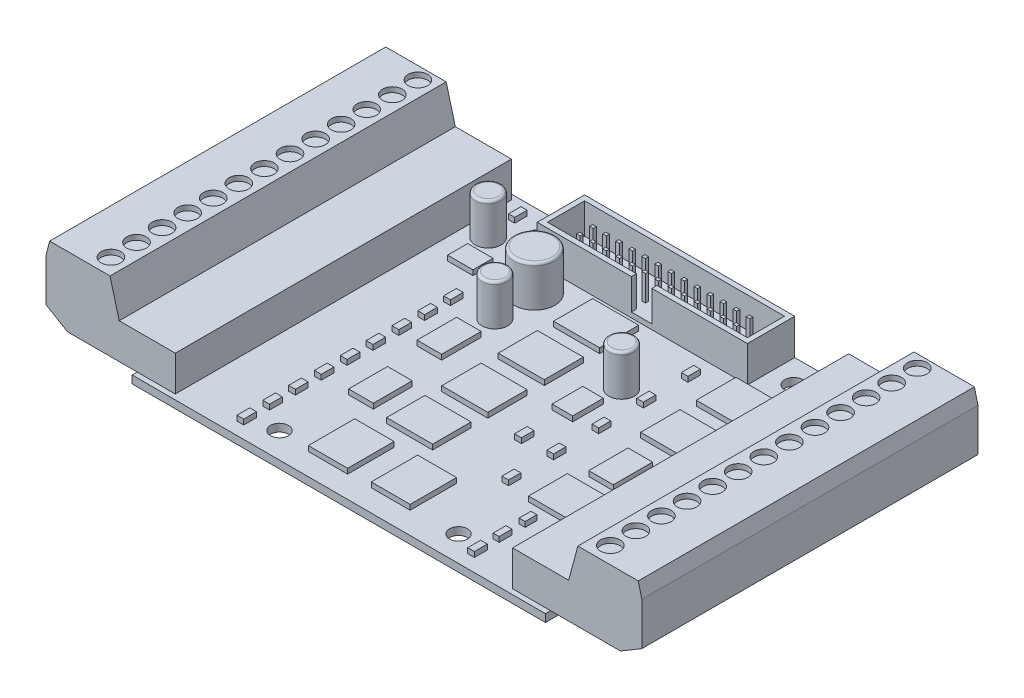
from build123d import *

# Parameters (mm, degrees)
SKETCH3_W           = 80.8
SKETCH3_H           = 67.7
SKETCH3_R           = 1.75
BOSS_EXTRUDE1_DEPTH = 1.5
SKETCH4_R           = 2.519657783
SKETCH4_R_2         = 4.004532687
SKETCH4_R_3         = 2.500407143
SKETCH4_R_4         = 2.502335513
SKETCH4_W           = 41.074253189
SKETCH4_H           = 9.252443791
SKETCH4_W_2         = 1.329022596
SKETCH4_H_2         = 2.489291791
SKETCH4_W_3         = 9.043722833
SKETCH4_H_3         = 7.744624526
SKETCH4_W_4         = 1.299098307
SKETCH4_H_4         = 2.423317997
SKETCH4_H_5         = 7.682547563
SKETCH4_H_6         = 2.438903988
SKETCH4_W_5         = 4.020192685
SKETCH4_H_7         = 6.000287589
SKETCH4_H_8         = 2.360113118
SKETCH4_W_6         = 4.798826301
SKETCH4_H_9         = 7.680510278
SKETCH4_W_7         = 8.973213678
SKETCH4_H_10        = 7.581709379
SKETCH4_W_8         = 8.999226764
SKETCH4_H_11        = 7.637060925
SKETCH4_H_12        = 7.638680033
SKETCH4_H_13        = 7.508285648
SKETCH4_W_9         = 1.353534488
SKETCH4_H_14        = 2.45168511
SKETCH4_H_15        = 2.426146723
SKETCH4_H_16        = 2.400608337
SKETCH4_W_10        = 1.177406115
SKETCH4_H_17        = 2.296944798
SKETCH4_H_18        = 2.498319459
SKETCH4_W_11        = 1.305968843
SKETCH4_H_19        = 2.531853948
SKETCH4_W_12        = 7.592772193
SKETCH4_H_20        = 9.071883658
SKETCH4_W_13        = 7.685500939
SKETCH4_W_14        = 4.831402337
SKETCH4_H_21        = 7.597617008
SKETCH4_W_15        = 4.794287262
SKETCH4_H_22        = 7.724129478
SKETCH4_W_16        = 4.959992836
SKETCH4_H_23        = 3.915783819
SKETCH4_W_17        = 1.208713917
SKETCH4_H_24        = 2.423087071
BOSS_EXTRUDE2_DEPTH = 1
BOSS_EXTRUDE3_START = -1
BOSS_EXTRUDE3_DEPTH = 65.7
BOSS_EXTRUDE4_DEPTH = 6
SKETCH6_3_W         = 0.702805105
SKETCH6_3_H         = 0.590356289
BOSS_EXTRUDE5_DEPTH = 5
SKETCH8_R           = 2.502335513
SKETCH8_R_2         = 2.500407143
SKETCH8_R_3         = 4.004532687
SKETCH8_R_4         = 2.519657783
BOSS_EXTRUDE6_DEPTH = 7
FILLET1_R           = 0.5
SKETCH9_R           = 1.912381088
CUT_EXTRUDE1_DEPTH  = 1


with BuildPart() as part:
    # Sketch3 → Boss-Extrude1 (new body)
    with BuildSketch(Plane(origin=(0, 0, 0), x_dir=(1, 0, 0), z_dir=(0, 1, 0))):
        Rectangle(SKETCH3_W, SKETCH3_H)
        with Locations(Location((-24.1, 29.15, 0), (0, 0, 270))):
            Circle(SKETCH3_R, mode=Mode.SUBTRACT)
        with Locations(Location((25.9, 29.15, 0), (0, 0, 270))):
            Circle(SKETCH3_R, mode=Mode.SUBTRACT)
        with Locations(Location((-16.6, -28.85, 0), (0, 0, 270))):
            Circle(SKETCH3_R, mode=Mode.SUBTRACT)
        with Locations(Location((18.4, -28.85, 0), (0, 0, 270))):
            Circle(SKETCH3_R, mode=Mode.SUBTRACT)
    extrude(amount=-BOSS_EXTRUDE1_DEPTH)

    # Sketch4 → Boss-Extrude2 (add)
    with BuildSketch(Plane(origin=(0, 0, 0), x_dir=(1, 0, 0), z_dir=(0, 1, 0))):
        with Locations(Location((-28.860526391, 24.21099068, 0), (0, 0, 270))):
            Circle(SKETCH4_R)
        with Locations(Location((-14.884448673, 19.266256309, 0), (0, 0, 270))):
            Circle(SKETCH4_R_2)
        with Locations(Location((-14.508312328, 11.15757865, 0), (0, 0, 270))):
            Circle(SKETCH4_R_3)
        with Locations(Location((9.776748131, 11.644789555, 0), (0, 0, 270))):
            Circle(SKETCH4_R_4)
        with Locations((0.869107225, 29.223778104)):
            Rectangle(SKETCH4_W, SKETCH4_H)
        with Locations((-21.694211323, 5.19158196)):
            Rectangle(SKETCH4_W_2, SKETCH4_H_2)
        with Locations((24.518139021, 19.892380071)):
            Rectangle(SKETCH4_W_3, SKETCH4_H_3)
        with Locations((14.500092457, 20.454489916)):
            Rectangle(SKETCH4_W_4, SKETCH4_H_4)
        with Locations((24.518139021, 8.996936065)):
            Rectangle(SKETCH4_W_3, SKETCH4_H_5)
        with Locations((14.500092457, 11.740703051)):
            Rectangle(SKETCH4_W_4, SKETCH4_H_6)
        with Locations((8.572453919, 4.27514885)):
            Rectangle(SKETCH4_W_5, SKETCH4_H_7)
        with Locations((14.500092457, 2.97508654)):
            Rectangle(SKETCH4_W_4, SKETCH4_H_8)
        with Locations((23.80564697, -2.565250083)):
            Rectangle(SKETCH4_W_6, SKETCH4_H_9)
        with Locations((24.311699922, -12.793514635)):
            Rectangle(SKETCH4_W_7, SKETCH4_H_10)
        with Locations((-2.829725204, 19.269771126)):
            Rectangle(SKETCH4_W_8, SKETCH4_H_11)
        with Locations((-2.829725204, 8.460957221)):
            Rectangle(SKETCH4_W_8, SKETCH4_H_12)
        with Locations((-2.829725204, -2.565250083)):
            Rectangle(SKETCH4_W_8, SKETCH4_H_9)
        with Locations((-2.829725204, -13.425306404)):
            Rectangle(SKETCH4_W_8, SKETCH4_H_13)
        with Locations((8.595687933, -6.197943008)):
            Rectangle(SKETCH4_W_9, SKETCH4_H_14)
        with Locations((14.500092457, -5.827636403)):
            Rectangle(SKETCH4_W_4, SKETCH4_H_15)
        with Locations((14.500092457, -14.625610573)):
            Rectangle(SKETCH4_W_4, SKETCH4_H_16)
        with Locations((23.216943912, -20.096080994)):
            Rectangle(SKETCH4_W_10, SKETCH4_H_17)
        with Locations((23.216943912, -25.067859946)):
            Rectangle(SKETCH4_W_10, SKETCH4_H_18)
        with Locations((23.281225277, -30.014197129)):
            Rectangle(SKETCH4_W_11, SKETCH4_H_19)
        with Locations((5.863688442, -25.034462774)):
            Rectangle(SKETCH4_W_12, SKETCH4_H_20)
        with Locations((-6.394292213, -25.034462774)):
            Rectangle(SKETCH4_W_13, SKETCH4_H_20)
        with Locations((-13.471115738, -12.248661286)):
            Rectangle(SKETCH4_W_14, SKETCH4_H_21)
        with Locations((-15.067275939, 2.77141156)):
            Rectangle(SKETCH4_W_15, SKETCH4_H_22)
        with Locations((-26.379970272, 18.230236397)):
            Rectangle(SKETCH4_W_16, SKETCH4_H_23)
        with Locations((-29.300812929, 30.43532164)):
            Rectangle(SKETCH4_W_17, SKETCH4_H_24)
        with Locations((-21.694211323, 10.241581959)):
            Rectangle(SKETCH4_W_2, SKETCH4_H_2)
        with Locations((-21.694211323, 0.141581959)):
            Rectangle(SKETCH4_W_2, SKETCH4_H_2)
        with Locations((-21.694211323, -4.908418041)):
            Rectangle(SKETCH4_W_2, SKETCH4_H_2)
        with Locations((-21.694211323, -9.95841804)):
            Rectangle(SKETCH4_W_2, SKETCH4_H_2)
        with Locations((-21.694211323, -15.008418041)):
            Rectangle(SKETCH4_W_2, SKETCH4_H_2)
        with Locations((-21.694211323, -20.058418041)):
            Rectangle(SKETCH4_W_2, SKETCH4_H_2)
        with Locations((-21.694211323, -25.108418041)):
            Rectangle(SKETCH4_W_2, SKETCH4_H_2)
        with Locations((-21.694211323, -30.158418041)):
            Rectangle(SKETCH4_W_2, SKETCH4_H_2)
    extrude(amount=BOSS_EXTRUDE2_DEPTH)

    # Sketch5 → Boss-Extrude3 (add)
    with BuildSketch(Plane.XY.offset(33.85).offset(BOSS_EXTRUDE3_START)):
        Polygon((-54.037193692, 0), (-32.958481681, 0), (-32.958481681, 6.91967846), (-43.923571691, 6.91967846), (-45.717519111, 13.609607381), (-57.524257941, 13.609607381), (-58.228687354, 10.83885169), (-58.228687354, 2.496386084), align=None)
        Polygon((32.958481681, 6.91967846), (32.958481681, 0), (54.037193692, 0), (58.228687354, 2.496386084), (58.228687354, 10.83885169), (57.524257941, 13.609607381), (45.717519111, 13.609607381), (43.923571691, 6.91967846), align=None)
    extrude(amount=-BOSS_EXTRUDE3_DEPTH)

    # Sketch6 → Boss-Extrude4 (add)
    with BuildSketch(Plane(origin=(0, 1, 0), x_dir=(1, 0, 0), z_dir=(0, 1, 0))):
        Polygon((2.733685616, 25.597556209), (2.733685616, 24.597556209), (21.406233819, 24.597556209), (21.406233819, 33.85), (-19.66801937, 33.85), (-19.66801937, 24.597556209), (-1.266314384, 24.597556209), (-1.266314384, 25.597556209), (-18.66801937, 25.597556209), (-18.66801937, 32.85), (20.406233819, 32.85), (20.406233819, 25.597556209), align=None)
    extrude(amount=BOSS_EXTRUDE4_DEPTH)

    # Sketch6<3> → Boss-Extrude5 (add)
    with BuildSketch(Plane(origin=(0, 1, 0), x_dir=(1, 0, 0), z_dir=(0, 1, 0))):
        with Locations((-14.50705477, 30.327179555)):
            Rectangle(SKETCH6_3_W, SKETCH6_3_H)
        with Locations((-11.95705477, 30.327179555)):
            Rectangle(SKETCH6_3_W, SKETCH6_3_H)
        with Locations((-9.40705477, 30.327179555)):
            Rectangle(SKETCH6_3_W, SKETCH6_3_H)
        with Locations((-6.85705477, 30.327179555)):
            Rectangle(SKETCH6_3_W, SKETCH6_3_H)
        with Locations((-14.50705477, 27.777179555)):
            Rectangle(SKETCH6_3_W, SKETCH6_3_H)
        with Locations((-11.95705477, 27.777179555)):
            Rectangle(SKETCH6_3_W, SKETCH6_3_H)
        with Locations((-9.40705477, 27.777179555)):
            Rectangle(SKETCH6_3_W, SKETCH6_3_H)
        with Locations((-6.85705477, 27.777179555)):
            Rectangle(SKETCH6_3_W, SKETCH6_3_H)
        with Locations((-4.30705477, 30.327179555)):
            Rectangle(SKETCH6_3_W, SKETCH6_3_H)
        with Locations((-4.30705477, 27.777179555)):
            Rectangle(SKETCH6_3_W, SKETCH6_3_H)
        with Locations((-1.75705477, 30.327179555)):
            Rectangle(SKETCH6_3_W, SKETCH6_3_H)
        with Locations((-1.75705477, 27.777179555)):
            Rectangle(SKETCH6_3_W, SKETCH6_3_H)
        with Locations((0.792945231, 30.327179555)):
            Rectangle(SKETCH6_3_W, SKETCH6_3_H)
        with Locations((0.792945231, 27.777179555)):
            Rectangle(SKETCH6_3_W, SKETCH6_3_H)
        with Locations((3.342945231, 30.327179555)):
            Rectangle(SKETCH6_3_W, SKETCH6_3_H)
        with Locations((3.342945231, 27.777179555)):
            Rectangle(SKETCH6_3_W, SKETCH6_3_H)
        with Locations((5.892945231, 30.327179555)):
            Rectangle(SKETCH6_3_W, SKETCH6_3_H)
        with Locations((5.892945231, 27.777179555)):
            Rectangle(SKETCH6_3_W, SKETCH6_3_H)
        with Locations((8.442945231, 30.327179555)):
            Rectangle(SKETCH6_3_W, SKETCH6_3_H)
        with Locations((8.442945231, 27.777179555)):
            Rectangle(SKETCH6_3_W, SKETCH6_3_H)
        with Locations((10.992945231, 30.327179555)):
            Rectangle(SKETCH6_3_W, SKETCH6_3_H)
        with Locations((10.992945231, 27.777179555)):
            Rectangle(SKETCH6_3_W, SKETCH6_3_H)
        with Locations((13.542945231, 30.327179555)):
            Rectangle(SKETCH6_3_W, SKETCH6_3_H)
        with Locations((13.542945231, 27.777179555)):
            Rectangle(SKETCH6_3_W, SKETCH6_3_H)
        with Locations((16.09294523, 30.327179555)):
            Rectangle(SKETCH6_3_W, SKETCH6_3_H)
        with Locations((16.09294523, 27.777179555)):
            Rectangle(SKETCH6_3_W, SKETCH6_3_H)
    extrude(amount=BOSS_EXTRUDE5_DEPTH)

    # Sketch8 → Boss-Extrude6 (add)
    with BuildSketch(Plane(origin=(0, 1, 0), x_dir=(1, 0, 0), z_dir=(0, 1, 0))):
        with Locations(Location((9.776748131, 11.644789555, 0), (0, 0, 270))):
            Circle(SKETCH8_R)
        with Locations(Location((-14.508312328, 11.15757865, 0), (0, 0, 270))):
            Circle(SKETCH8_R_2)
        with Locations(Location((-14.884448673, 19.266256309, 0), (0, 0, 270))):
            Circle(SKETCH8_R_3)
        with Locations(Location((-28.860526391, 24.21099068, 0), (0, 0, 270))):
            Circle(SKETCH8_R_4)
    extrude(amount=BOSS_EXTRUDE6_DEPTH)

    # Fillet1
    fillet1_edges = [part.edges().sort_by_distance(p)[0] for p in [
        (9.776748131, 8, -14.147125068),
        (-14.508312328, 8, -13.657985793),
        (-14.884448673, 8, -23.270788997),
        (-28.860526391, 8, -26.730648463),
    ]]
    fillet(fillet1_edges, radius=FILLET1_R)

    # Sketch9 → Cut-Extrude1 (cut)
    with BuildSketch(Plane(origin=(0, 13.609607381, 0), x_dir=(1, 0, 0), z_dir=(0, 1, 0))):
        with Locations(Location((-48.800237871, 30.412257538, 0), (0, 0, 180))):
            Circle(SKETCH9_R)
        with Locations(Location((-48.800237871, 25.412257538, 0), (0, 0, 180))):
            Circle(SKETCH9_R)
        with Locations(Location((-48.800237871, 20.412257538, 0), (0, 0, 180))):
            Circle(SKETCH9_R)
        with Locations(Location((-48.800237871, 15.412257538, 0), (0, 0, 180))):
            Circle(SKETCH9_R)
        with Locations(Location((-48.800237871, 10.412257538, 0), (0, 0, 180))):
            Circle(SKETCH9_R)
        with Locations(Location((-48.800237871, 5.412257538, 0), (0, 0, 180))):
            Circle(SKETCH9_R)
        with Locations(Location((-48.800237871, 0.412257538, 0), (0, 0, 180))):
            Circle(SKETCH9_R)
        with Locations(Location((-48.800237871, -4.587742462, 0), (0, 0, 180))):
            Circle(SKETCH9_R)
        with Locations(Location((-48.800237871, -9.587742462, 0), (0, 0, 180))):
            Circle(SKETCH9_R)
        with Locations(Location((-48.800237871, -14.587742462, 0), (0, 0, 180))):
            Circle(SKETCH9_R)
        with Locations(Location((-48.800237871, -19.587742462, 0), (0, 0, 180))):
            Circle(SKETCH9_R)
        with Locations(Location((-48.800237871, -24.587742462, 0), (0, 0, 180))):
            Circle(SKETCH9_R)
        with Locations(Location((-48.800237871, -29.587742462, 0), (0, 0, 180))):
            Circle(SKETCH9_R)
        with Locations((48.800237871, -29.587742462)):
            Circle(SKETCH9_R)
        with Locations((48.800237871, -24.587742462)):
            Circle(SKETCH9_R)
        with Locations((48.800237871, -19.587742462)):
            Circle(SKETCH9_R)
        with Locations((48.800237871, -14.587742462)):
            Circle(SKETCH9_R)
        with Locations((48.800237871, -9.587742462)):
            Circle(SKETCH9_R)
        with Locations((48.800237871, -4.587742462)):
            Circle(SKETCH9_R)
        with Locations((48.800237871, 0.412257538)):
            Circle(SKETCH9_R)
        with Locations((48.800237871, 5.412257538)):
            Circle(SKETCH9_R)
        with Locations((48.800237871, 10.412257538)):
            Circle(SKETCH9_R)
        with Locations((48.800237871, 15.412257538)):
            Circle(SKETCH9_R)
        with Locations((48.800237871, 20.412257538)):
            Circle(SKETCH9_R)
        with Locations((48.800237871, 25.412257538)):
            Circle(SKETCH9_R)
        with Locations((48.800237871, 30.412257538)):
            Circle(SKETCH9_R)
    extrude(amount=-CUT_EXTRUDE1_DEPTH, mode=Mode.SUBTRACT)


solid = part.part
